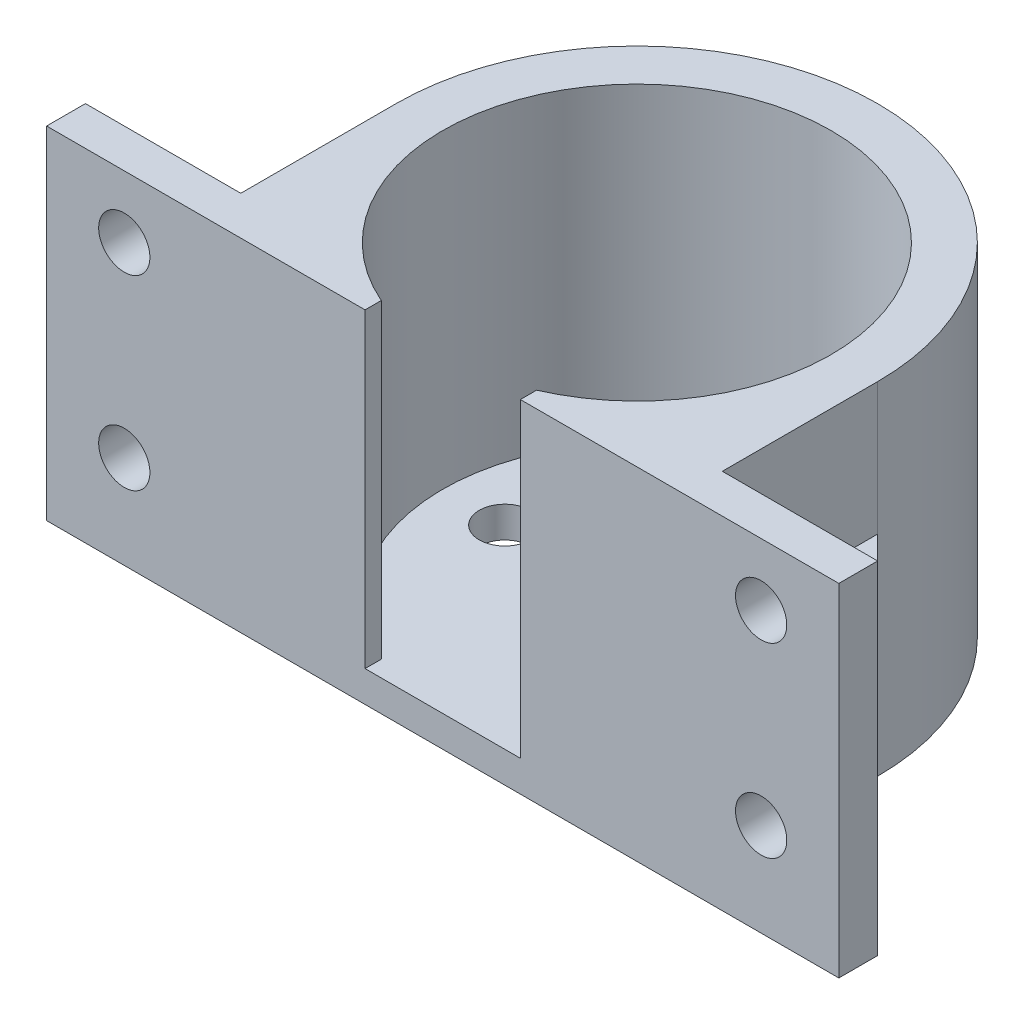
from build123d import *

# Parameters (mm, degrees)
BOSS_EXTRUDE1_DEPTH = 20
RIB1_REACH          = 33.472
SKETCH3_WALL_W      = 79.086555552
SKETCH3_WALL_H      = 3
SKETCH4_R           = 1.65
CUT_EXTRUDE2_DEPTH  = 18
BOSS_EXTRUDE2_START = -2
SKETCH1_4_R         = 1.65
SKETCH1_4_R_2       = 4.5
BOSS_EXTRUDE2_DEPTH = 2


with BuildPart() as part:
    # Sketch1 → Boss-Extrude1 (new body)
    with BuildSketch(Plane(origin=(0, 0, 0), x_dir=(1, 0, 0), z_dir=(0, 1, 0))):
        with BuildLine():
            Line((-25.5, -10), (-25.5, -12.5))
            Line((-25.5, -12.5), (-5, -12.5))
            Line((-5, -12.5), (-5, -11.456439237))
            ThreePointArc((-5, -11.456439237), (0, 12.5), (5, -11.456439237))
            Line((5, -11.456439237), (5, -12.5))
            Line((5, -12.5), (25.5, -12.5))
            Line((25.5, -12.5), (25.5, -10))
            Line((25.5, -10), (15.5, -10))
            Line((15.5, -10), (15.5, 0))
            ThreePointArc((15.5, 0), (0, 15.5), (-15.5, 0))
            Line((-15.5, 0), (-15.5, -10))
            Line((-15.5, -10), (-25.5, -10))
        make_face()
    extrude(amount=BOSS_EXTRUDE1_DEPTH)

    # Sketch3 wall → Rib1 (add, up to next)
    with BuildSketch(Plane(origin=(20.5, 10, 5), x_dir=(0.707106781187, 0, 0.707106781187), z_dir=(0.707106781187, 0, -0.707106781187)), mode=Mode.PRIVATE) as rib1_sk1:
        Rectangle(SKETCH3_WALL_W, SKETCH3_WALL_H)
    rib1_tool1 = extrude(rib1_sk1.sketch, amount=-RIB1_REACH, mode=Mode.PRIVATE) - part.part
    rib1 = rib1_tool1.solids().sort_by_distance((20.5, 10, 5))[0]
    add(rib1)

    # Mirror1: Rib1 across plane
    add(rib1.mirror(Plane(origin=(0, 0, 0), x_dir=(0, 0, 1), z_dir=(1, 0, 0))))

    # Sketch4 → Cut-Extrude2 (cut)
    with BuildSketch(Plane.XY):
        with Locations((20.5, 16)):
            Circle(SKETCH4_R)
        with Locations((20.5, 4)):
            Circle(SKETCH4_R)
    cut_extrude2 = extrude(amount=CUT_EXTRUDE2_DEPTH, mode=Mode.SUBTRACT)

    # Mirror2: Cut-Extrude2 across plane
    add(cut_extrude2.mirror(Plane(origin=(0, 0, 0), x_dir=(0, 0, 1), z_dir=(1, 0, 0))), mode=Mode.SUBTRACT)

    # Sketch1<4> → Boss-Extrude2 (add)
    with BuildSketch(Plane(origin=(0, 0, 0), x_dir=(1, 0, 0), z_dir=(0, 1, 0)).offset(BOSS_EXTRUDE2_START)):
        with BuildLine():
            Line((-25.5, -10), (-25.5, -12.5))
            Line((-25.5, -12.5), (25.5, -12.5))
            Line((25.5, -12.5), (25.5, -10))
            Line((25.5, -10), (15.5, -10))
            Line((15.5, -10), (15.5, 0))
            ThreePointArc((15.5, 0), (0, 15.5), (-15.5, 0))
            Line((-15.5, 0), (-15.5, -10))
            Line((-15.5, -10), (-25.5, -10))
        make_face()
        with Locations((-8.5, 0)):
            Circle(SKETCH1_4_R, mode=Mode.SUBTRACT)
        Circle(SKETCH1_4_R_2, mode=Mode.SUBTRACT)
        with Locations((8.5, 0)):
            Circle(SKETCH1_4_R, mode=Mode.SUBTRACT)
    extrude(amount=BOSS_EXTRUDE2_DEPTH)


solid = part.part
